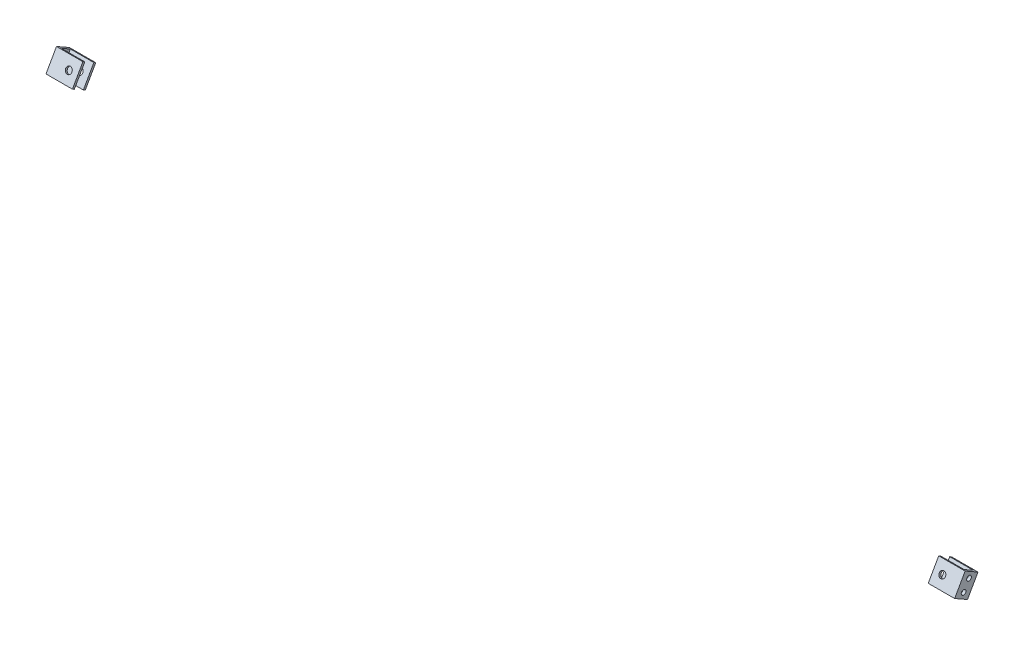
from build123d import *

# Parameters (mm, degrees)
SKETCH1_W           = 28.321
SKETCH1_H           = 22.86
SKETCH1_R           = 3.3782
BOSS_EXTRUDE1_DEPTH = 7.9375
SKETCH2_W           = 31.794417924
SKETCH2_H           = 11.1125
CUT_EXTRUDE1_DEPTH  = 671.322198878
SKETCH3_R           = 2.5527
CUT_EXTRUDE2_DEPTH  = 1373.363784194


with BuildPart() as part:
    # Sketch1 → Boss-Extrude1 (new, symmetric)
    with BuildSketch(Plane(origin=(0, -217.945214779, -384.948202745), x_dir=(-1, 0, 0), z_dir=(0, -0.4926838295770631, -0.8702083911760905))):
        with Locations((473.289499952, 1279.170858512)):
            Rectangle(SKETCH1_W, SKETCH1_H)
        with Locations(Location((468.653999952, 1279.170858512, 0), (0, 0, 90))):
            Circle(SKETCH1_R, mode=Mode.SUBTRACT)
    extrude(amount=BOSS_EXTRUDE1_DEPTH, both=True)

    # Sketch2 → Cut-Extrude1 (cut, through all)
    with BuildSketch(Plane(origin=(0, 1103.198732914, -624.595421083), x_dir=(1, 0, 0), z_dir=(0, -0.8702083911760902, 0.4926838295770632))):
        with Locations((-468.37779099, -442.363239252)):
            Rectangle(SKETCH2_W, SKETCH2_H)
    extrude(amount=-CUT_EXTRUDE1_DEPTH, mode=Mode.SUBTRACT)

    # Sketch3 → Cut-Extrude2 (cut, through all)
    with BuildSketch(Plane.ZY.offset(487.449999952)):
        with Locations((-1018.065773102, 900.30586076)):
            Circle(SKETCH3_R)
        with Locations((-1012.284226898, 890.094139332)):
            Circle(SKETCH3_R)
        with Locations((0, 890.821943017)):
            Circle(SKETCH3_R)
    extrude(amount=-CUT_EXTRUDE2_DEPTH, mode=Mode.SUBTRACT)


with BuildPart() as body_2:
    # Mirror2: mirrored copy
    add(part.part.mirror(Plane(origin=(0, 0, 0), x_dir=(0, 0, 1), z_dir=(1, 0, 0))))


solid = Compound([part.part, body_2.part])
